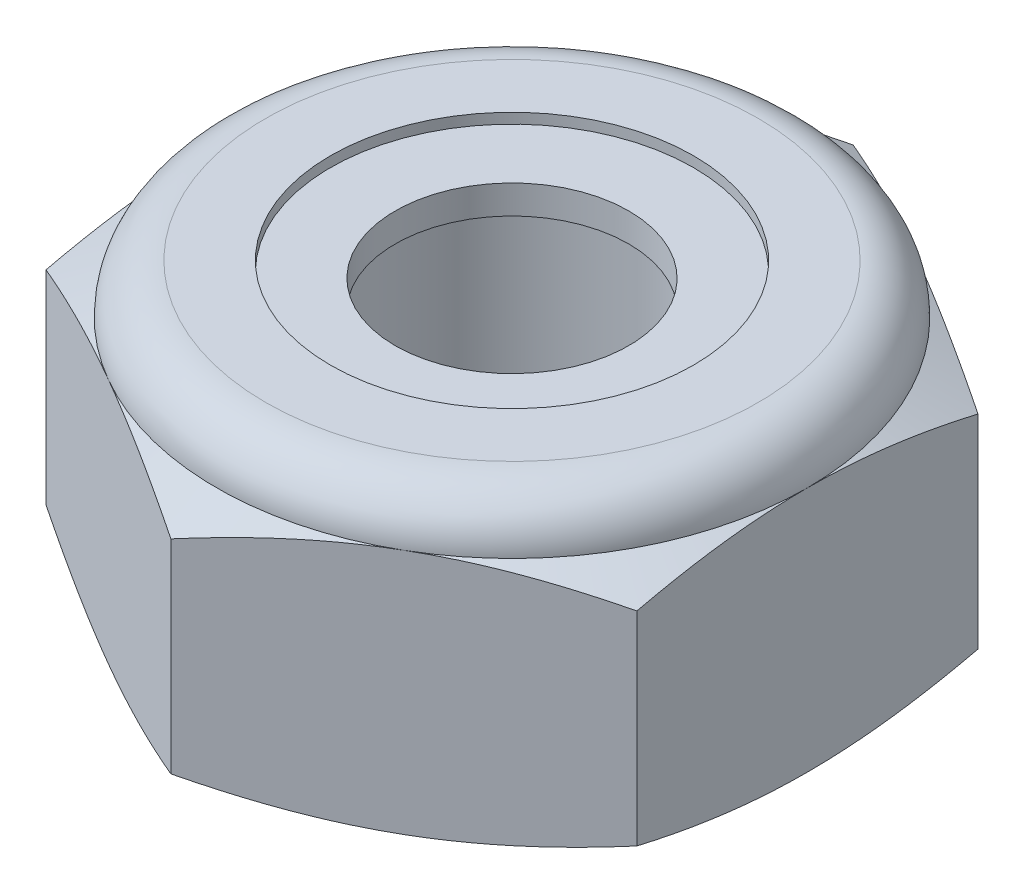
from build123d import *

# Parameters (mm, degrees)
EXTRUDE1_DEPTH = 4.365625
SKETCH2_W      = 2.0828
SKETCH2_H      = 4.365625


with BuildPart() as part:
    # Sketch1 → Extrude1 (new body)
    with BuildSketch(Plane(origin=(0, 0, 0), x_dir=(1, 0, 0), z_dir=(0, 1, 0))):
        Polygon((0, 5.040989538), (-4.365625, 2.520494769), (-4.365625, -2.520494769), (0, -5.040989538), (4.365625, -2.520494769), (4.365625, 2.520494769), align=None)
    extrude(amount=EXTRUDE1_DEPTH)


with BuildPart() as body_2:
    # Sketch2 → Revolve1 (revolve)
    with BuildSketch(Plane(origin=(0, 0, 0), x_dir=(0, 0, -1), z_dir=(1, 0, 0))):
        with Locations((1.0414, 2.1828125)):
            Rectangle(SKETCH2_W, SKETCH2_H)
    revolve(axis=Axis((0, -2.0828, 0), (0, 1, 0)))


with BuildPart() as part_1:
    add(part.part)

    # Combine1: cut body 2
    add(body_2.part, mode=Mode.SUBTRACT)

    # Sketch5 → Cut-Revolve3 (revolve, cut)
    with BuildSketch(Plane(origin=(0, 0, 0), x_dir=(0, 0, -1), z_dir=(1, 0, 0))):
        with BuildLine():
            Line((0, 0), (4.365625, 0))
            Line((4.365625, 0), (5.040989538, 0.314927656))
            Line((5.040989538, 0.314927656), (5.040989538, 3.323093177))
            Line((5.040989538, 3.323093177), (4.365625, 3.638020833))
            ThreePointArc((4.365625, 3.638020833), (4.152514674, 4.152514674), (3.638020833, 4.365625))
            Line((3.638020833, 4.365625), (3.638020833, 5.635625))
            Line((3.638020833, 5.635625), (6.310989538, 5.635625))
            Line((6.310989538, 5.635625), (6.310989538, -1.27))
            Line((6.310989538, -1.27), (0, -1.27))
            Line((0, -1.27), (0, 0))
        make_face()
    revolve(axis=Axis((0, 0, 0), (0, 1, 0)), mode=Mode.SUBTRACT)

    # Sketch6 → Cut-Revolve4 (revolve, cut)
    with BuildSketch(Plane(origin=(0, 0, 0), x_dir=(0, 0, -1), z_dir=(1, 0, 0))):
        with BuildLine():
            Line((0, 3.638020833), (4.213225, 3.638020833))
            ThreePointArc((4.213225, 3.638020833), (4.0447516, 4.0447516), (3.638020833, 4.213225))
            Line((3.638020833, 4.213225), (2.681893026, 4.213225))
            Line((2.681893026, 4.213225), (2.681893026, 5.635625))
            Line((2.681893026, 5.635625), (0, 5.635625))
            Line((0, 5.635625), (0, 3.638020833))
        make_face()
    revolve(axis=Axis((0, 5.635625, 0), (0, 1, 0)), mode=Mode.SUBTRACT)


with BuildPart() as body_2_2:
    # Sketch7 → Revolve2 (revolve)
    with BuildSketch(Plane(origin=(0, 0, 0), x_dir=(0, 0, -1), z_dir=(1, 0, 0))):
        with BuildLine():
            Line((1.725765218, 3.714220833), (4.131172654, 3.714220833))
            ThreePointArc((4.131172654, 3.714220833), (3.962813876, 4.016854092), (3.638020833, 4.137025))
            Line((3.638020833, 4.137025), (1.725765218, 4.137025))
            Line((1.725765218, 4.137025), (1.725765218, 3.714220833))
        make_face()
    revolve(axis=Axis((0, 3.714220833, 0), (0, 1, 0)))


solid = Compound([part_1.part, body_2_2.part])
